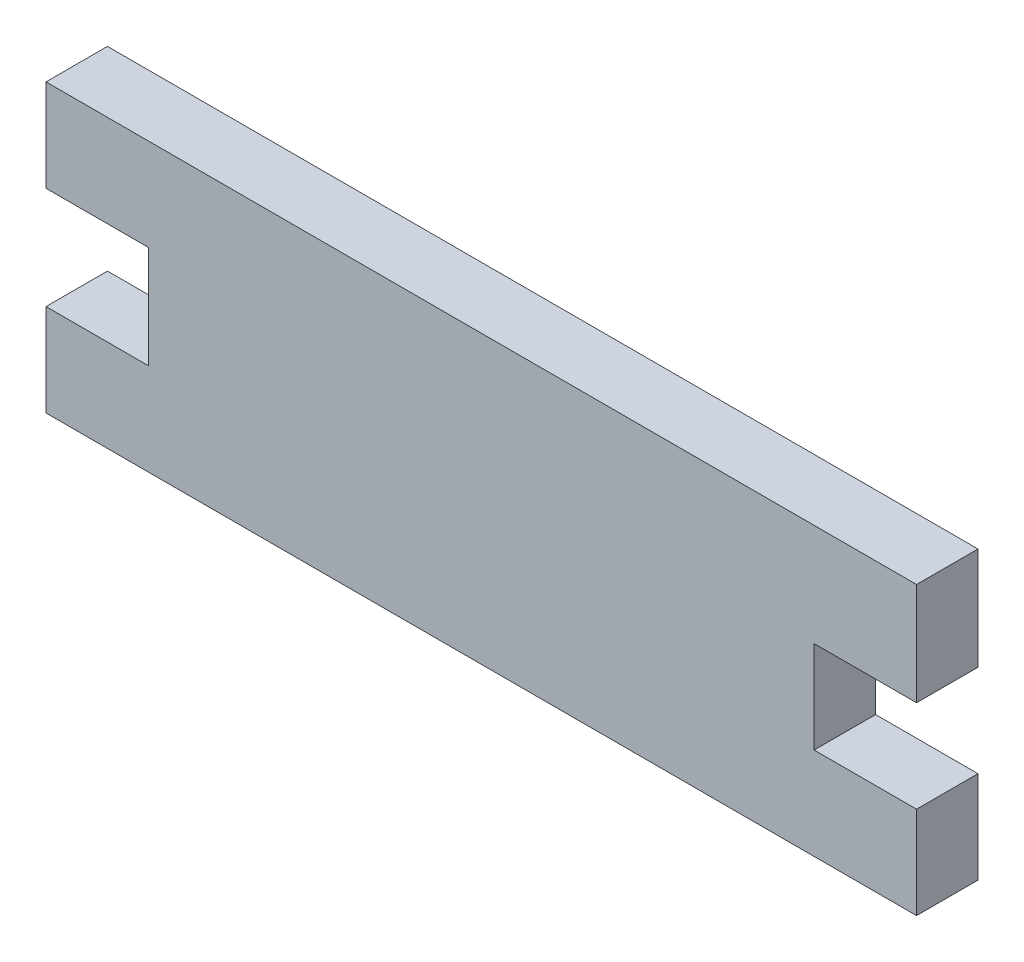
from build123d import *

# Parameters (mm, degrees)
BOSS_EXTRU_1_DEPTH = 3


with BuildPart() as part:
    # Esquisse1 → Boss.-Extru.1 (new body)
    with BuildSketch(Plane.XY):
        Polygon((-16.509641766, 7.163572353), (25.990358234, 7.163572353), (25.990358234, 2.163572353), (20.990358234, 2.163572353), (20.990358234, -2.336427647), (25.990358234, -2.336427647), (25.990358234, -6.836427647), (-16.509641766, -6.836427647), (-16.509641766, -2.336427647), (-11.509641766, -2.336427647), (-11.509641766, 2.663572353), (-16.509641766, 2.663572353), align=None)
    extrude(amount=BOSS_EXTRU_1_DEPTH)


solid = part.part
